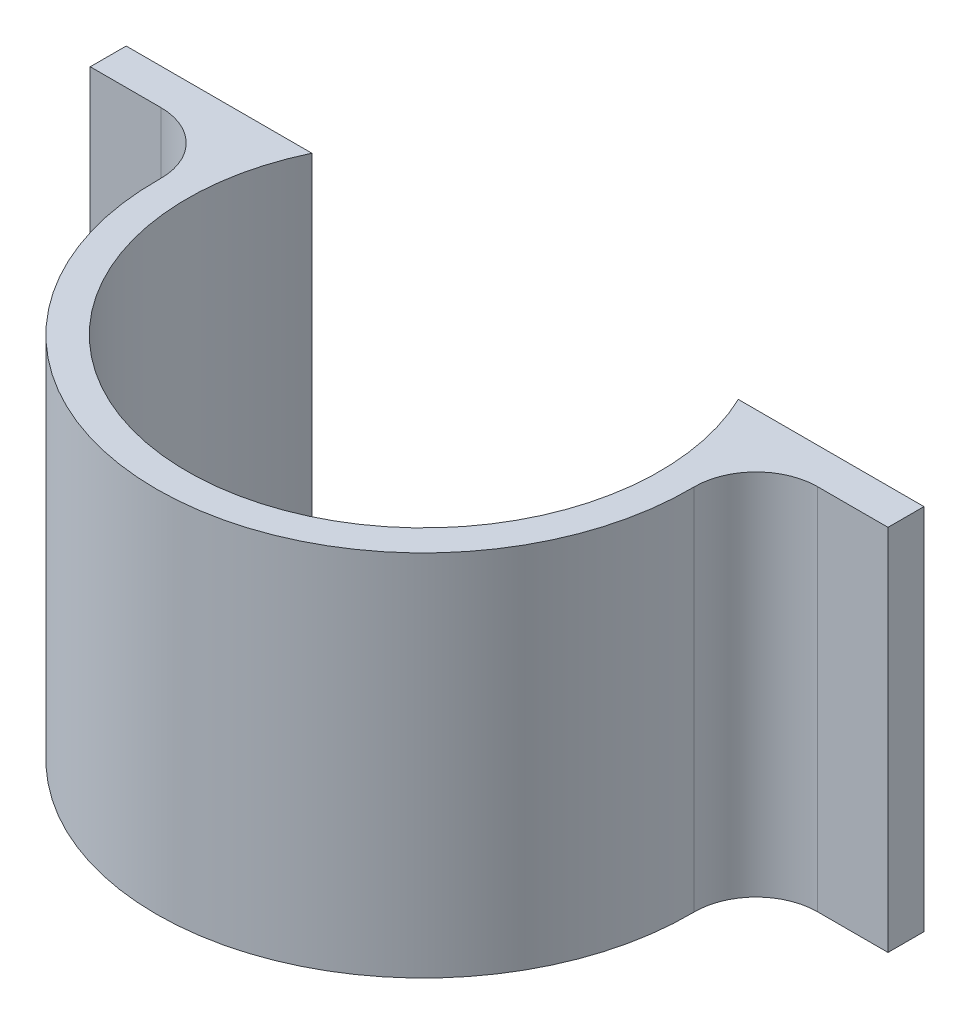
from build123d import *

# Parameters (mm, degrees)
BOSS_EXTRUDE2_DEPTH = 60
FILLET3_R           = 10


with BuildPart() as part:
    # Sketch1 → Boss-Extrude2 (new body)
    with BuildSketch(Plane(origin=(0, 0, 0), x_dir=(1, 0, 0), z_dir=(0, 1, 0))):
        with BuildLine():
            Line((-65, 10.711576414), (-42.160551831, 10.711576414))
            ThreePointArc((-42.160551831, 10.711576414), (0, -43.5), (42.160551831, 10.711576414))
            Line((42.160551831, 10.711576414), (65, 10.711576414))
            Line((65, 10.711576414), (65, 16.568265676))
            Line((65, 16.568265676), (34.752590874, 16.568265676))
            ThreePointArc((34.752590874, 16.568265676), (0, -38.5), (-34.752590874, 16.568265676))
            Line((-34.752590874, 16.568265676), (-65, 16.568265676))
            Line((-65, 16.568265676), (-65, 10.711576414))
        make_face()
    extrude(amount=BOSS_EXTRUDE2_DEPTH)

    # Fillet3
    fillet3_edges = [part.edges().sort_by_distance(p)[0] for p in [
        (42.160551831, 30, -10.711576414),
        (-42.160551831, 30, -10.711576414),
    ]]
    fillet(fillet3_edges, radius=FILLET3_R)


solid = part.part
